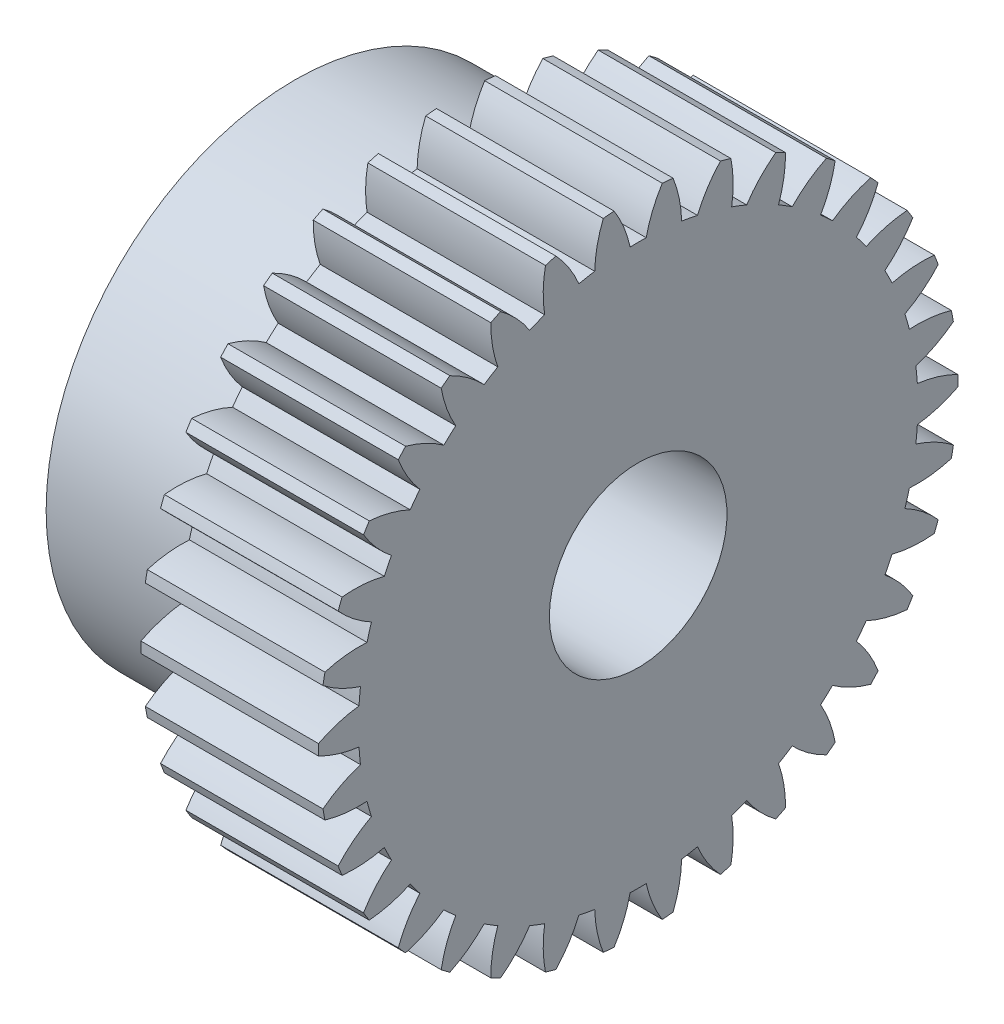
from build123d import *

# Parameters (mm, degrees)
BASPROSKE_W      = 15
BASPROSKE_H      = 27
TOOTHCUT_DEPTH   = 42.024382994
TEETHCUTS_COUNT  = 34
TEETHCUTS_ANGLE  = 349.411764706
HUBNEAONESKE_R   = 21
HUBNEARONE_DEPTH = 14.0000508
BORSKE_R         = 7.5
BORE_DEPTH       = 29.0000508


with BuildPart() as part:
    # BasProSke → Base-Revolve (revolve)
    with BuildSketch(Plane(origin=(0, 0, 0), x_dir=(1, 0, 0), z_dir=(0, 1, 0)), mode=Mode.PRIVATE) as base_revolve_sk:
        with Locations((7.5, 13.5)):
            Rectangle(BASPROSKE_W, BASPROSKE_H)
    revolve(base_revolve_sk.sketch.rotate(Axis((-10, 0, 0), (1, 0, 0)), 180), axis=Axis((-10, 0, 0), (1, 0, 0)))

    # TooCutSke → ToothCut (cut, through all)
    with BuildSketch(Plane(origin=(0, 0, 0), x_dir=(0, 0, -1), z_dir=(1, 0, 0))):
        with BuildLine():
            ThreePointArc((0.680843935, 23.614186997), (0, 23.624), (-0.680843935, 23.614186997))
            ThreePointArc((-0.680843935, 23.614186997), (-1.217418416, 25.341814067), (-2.050752373, 26.947479657))
            ThreePointArc((-2.050752373, 26.947479657), (0, 27.0254), (2.050752373, 26.947479657))
            ThreePointArc((2.050752373, 26.947479657), (1.217418416, 25.341814067), (0.680843935, 23.614186997))
        make_face()
    toothcut = extrude(amount=TOOTHCUT_DEPTH, mode=Mode.SUBTRACT)

    # TeethCuts: ToothCut ×34 about axis
    teethcuts_axis = Axis((-10, 0, 0), (1, 0, 0))
    for i in range(1, TEETHCUTS_COUNT):
        add(toothcut.rotate(teethcuts_axis, i * TEETHCUTS_ANGLE / (TEETHCUTS_COUNT - 1)), mode=Mode.SUBTRACT)

    # HubNeaOneSke → HubNearOne (add)
    with BuildSketch(Plane.ZY):
        with Locations(Location((0, 0, 0), (0, 0, 180))):
            Circle(HUBNEAONESKE_R)
    extrude(amount=HUBNEARONE_DEPTH)

    # BorSke → Bore (cut, symmetric)
    with BuildSketch(Plane(origin=(0, 0, 0), x_dir=(0, 0, -1), z_dir=(1, 0, 0))):
        with Locations(Location((0, 0, 0), (0, 0, 180))):
            Circle(BORSKE_R)
    extrude(amount=BORE_DEPTH, both=True, mode=Mode.SUBTRACT)


solid = part.part
